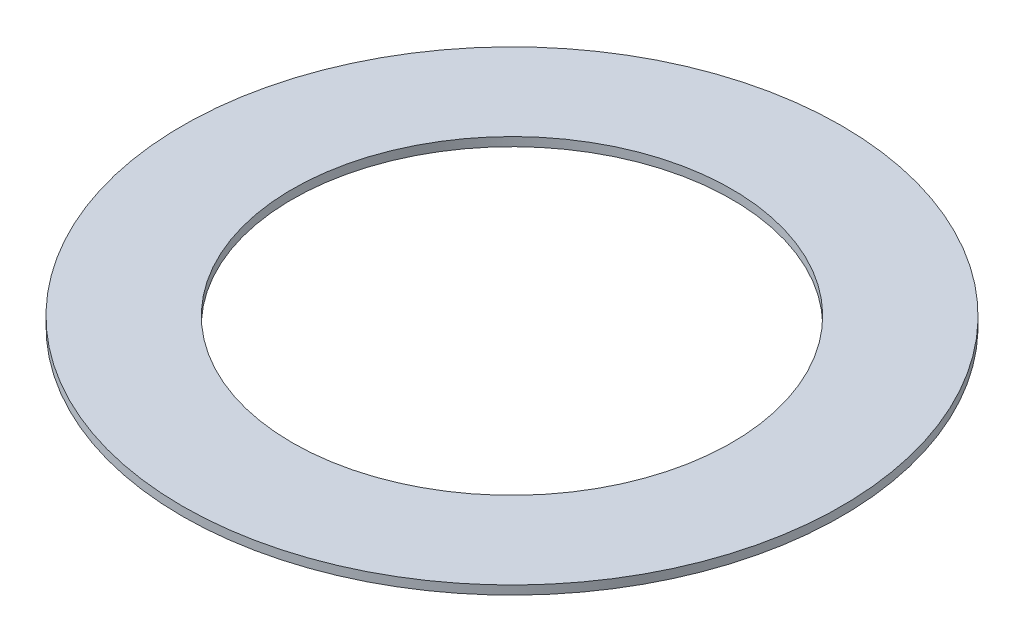
from build123d import *

# Parameters (mm, degrees)
SKETCH1_R           = 4.7625
SKETCH1_R_2         = 3.175
BOSS_EXTRUDE1_DEPTH = 0.127


with BuildPart() as part:
    # Sketch1 → Boss-Extrude1 (new body)
    with BuildSketch(Plane(origin=(0, 0, 0), x_dir=(1, 0, 0), z_dir=(0, 1, 0))):
        with Locations(Location((0, 0, 0), (0, 0, 270))):
            Circle(SKETCH1_R)
        with Locations(Location((0, 0, 0), (0, 0, 270))):
            Circle(SKETCH1_R_2, mode=Mode.SUBTRACT)
    extrude(amount=BOSS_EXTRUDE1_DEPTH)


solid = part.part
